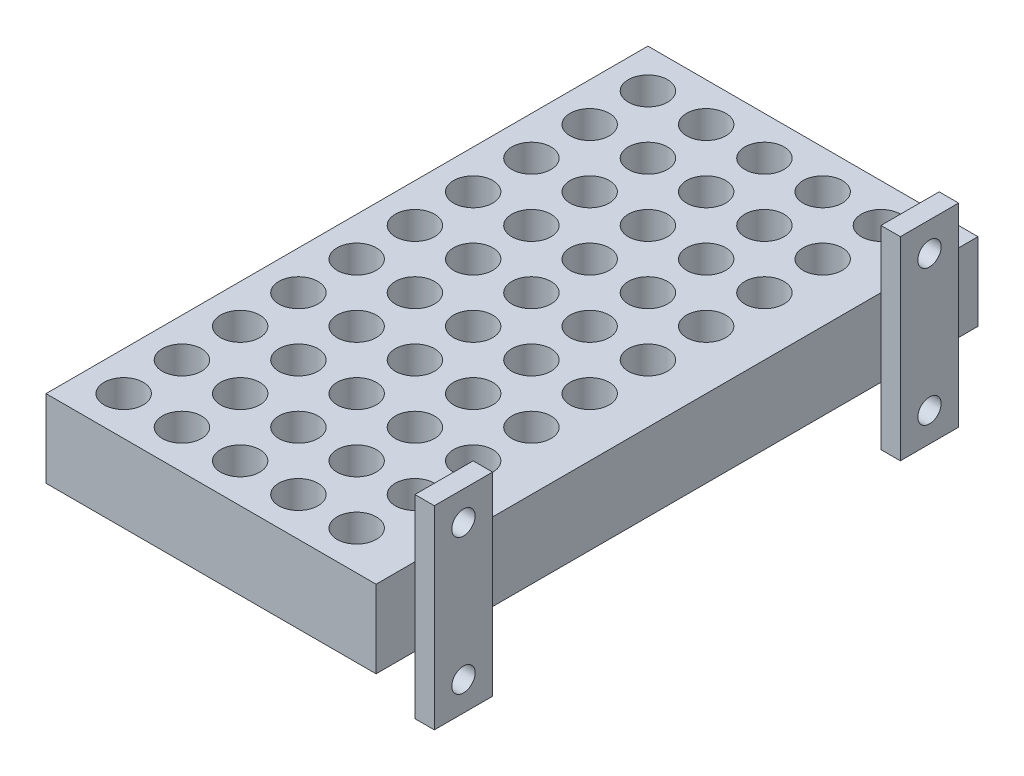
from build123d import *

# Parameters (mm, degrees)
SKETCH1_W           = 85
SKETCH1_H           = 155
BOSS_EXTRUDE1_DEPTH = 20
SKETCH3_R           = 5.05
CUT_EXTRUDE1_DEPTH  = 10
SKETCH5_W           = 15
SKETCH5_H           = 50
BOSS_EXTRUDE2_DEPTH = 5
SKETCH6_R           = 3
CUT_EXTRUDE2_DEPTH  = 5


with BuildPart() as part:
    # Sketch1 → Boss-Extrude1 (new body)
    with BuildSketch(Plane(origin=(0, 0, 0), x_dir=(1, 0, 0), z_dir=(0, 1, 0))):
        with Locations((42.5, 77.5)):
            Rectangle(SKETCH1_W, SKETCH1_H)
    extrude(amount=BOSS_EXTRUDE1_DEPTH)

    # Sketch3 → Cut-Extrude1 (cut)
    with BuildSketch(Plane(origin=(0, 20, 0), x_dir=(1, 0, 0), z_dir=(0, 1, 0))):
        with Locations(Location((10, 145, 0), (0, 0, 270))):
            Circle(SKETCH3_R)
        with Locations(Location((25, 145, 0), (0, 0, 270))):
            Circle(SKETCH3_R)
        with Locations(Location((40, 145, 0), (0, 0, 270))):
            Circle(SKETCH3_R)
        with Locations(Location((55, 145, 0), (0, 0, 270))):
            Circle(SKETCH3_R)
        with Locations(Location((70, 145, 0), (0, 0, 270))):
            Circle(SKETCH3_R)
        with Locations(Location((70, 130, 0), (0, 0, 270))):
            Circle(SKETCH3_R)
        with Locations(Location((55, 130, 0), (0, 0, 270))):
            Circle(SKETCH3_R)
        with Locations(Location((40, 130, 0), (0, 0, 270))):
            Circle(SKETCH3_R)
        with Locations(Location((25, 130, 0), (0, 0, 270))):
            Circle(SKETCH3_R)
        with Locations(Location((10, 130, 0), (0, 0, 270))):
            Circle(SKETCH3_R)
        with Locations(Location((70, 115, 0), (0, 0, 270))):
            Circle(SKETCH3_R)
        with Locations(Location((55, 115, 0), (0, 0, 270))):
            Circle(SKETCH3_R)
        with Locations(Location((40, 115, 0), (0, 0, 270))):
            Circle(SKETCH3_R)
        with Locations(Location((25, 115, 0), (0, 0, 270))):
            Circle(SKETCH3_R)
        with Locations(Location((10, 115, 0), (0, 0, 270))):
            Circle(SKETCH3_R)
        with Locations(Location((70, 100, 0), (0, 0, 270))):
            Circle(SKETCH3_R)
        with Locations(Location((55, 100, 0), (0, 0, 270))):
            Circle(SKETCH3_R)
        with Locations(Location((40, 100, 0), (0, 0, 270))):
            Circle(SKETCH3_R)
        with Locations(Location((25, 100, 0), (0, 0, 270))):
            Circle(SKETCH3_R)
        with Locations(Location((10, 100, 0), (0, 0, 270))):
            Circle(SKETCH3_R)
        with Locations(Location((70, 85, 0), (0, 0, 270))):
            Circle(SKETCH3_R)
        with Locations(Location((55, 85, 0), (0, 0, 270))):
            Circle(SKETCH3_R)
        with Locations(Location((40, 85, 0), (0, 0, 270))):
            Circle(SKETCH3_R)
        with Locations(Location((25, 85, 0), (0, 0, 270))):
            Circle(SKETCH3_R)
        with Locations(Location((10, 85, 0), (0, 0, 270))):
            Circle(SKETCH3_R)
        with Locations(Location((70, 70, 0), (0, 0, 270))):
            Circle(SKETCH3_R)
        with Locations(Location((55, 70, 0), (0, 0, 270))):
            Circle(SKETCH3_R)
        with Locations(Location((40, 70, 0), (0, 0, 270))):
            Circle(SKETCH3_R)
        with Locations(Location((25, 70, 0), (0, 0, 270))):
            Circle(SKETCH3_R)
        with Locations(Location((10, 70, 0), (0, 0, 270))):
            Circle(SKETCH3_R)
        with Locations(Location((70, 55, 0), (0, 0, 270))):
            Circle(SKETCH3_R)
        with Locations(Location((55, 55, 0), (0, 0, 270))):
            Circle(SKETCH3_R)
        with Locations(Location((40, 55, 0), (0, 0, 270))):
            Circle(SKETCH3_R)
        with Locations(Location((25, 55, 0), (0, 0, 270))):
            Circle(SKETCH3_R)
        with Locations(Location((10, 55, 0), (0, 0, 270))):
            Circle(SKETCH3_R)
        with Locations(Location((70, 40, 0), (0, 0, 270))):
            Circle(SKETCH3_R)
        with Locations(Location((55, 40, 0), (0, 0, 270))):
            Circle(SKETCH3_R)
        with Locations(Location((40, 40, 0), (0, 0, 270))):
            Circle(SKETCH3_R)
        with Locations(Location((25, 40, 0), (0, 0, 270))):
            Circle(SKETCH3_R)
        with Locations(Location((10, 40, 0), (0, 0, 270))):
            Circle(SKETCH3_R)
        with Locations(Location((70, 25, 0), (0, 0, 270))):
            Circle(SKETCH3_R)
        with Locations(Location((55, 25, 0), (0, 0, 270))):
            Circle(SKETCH3_R)
        with Locations(Location((40, 25, 0), (0, 0, 270))):
            Circle(SKETCH3_R)
        with Locations(Location((25, 25, 0), (0, 0, 270))):
            Circle(SKETCH3_R)
        with Locations(Location((10, 25, 0), (0, 0, 270))):
            Circle(SKETCH3_R)
        with Locations(Location((70, 10, 0), (0, 0, 270))):
            Circle(SKETCH3_R)
        with Locations(Location((55, 10, 0), (0, 0, 270))):
            Circle(SKETCH3_R)
        with Locations(Location((40, 10, 0), (0, 0, 270))):
            Circle(SKETCH3_R)
        with Locations(Location((25, 10, 0), (0, 0, 270))):
            Circle(SKETCH3_R)
        with Locations(Location((10, 10, 0), (0, 0, 270))):
            Circle(SKETCH3_R)
    extrude(amount=-CUT_EXTRUDE1_DEPTH, mode=Mode.SUBTRACT)

    # Sketch5 → Boss-Extrude2 (add)
    with BuildSketch(Plane(origin=(85, 0, 0), x_dir=(0, 0, -1), z_dir=(1, 0, 0))):
        with Locations((17.5, 10)):
            Rectangle(SKETCH5_W, SKETCH5_H)
        with Locations((137.5, 10)):
            Rectangle(SKETCH5_W, SKETCH5_H)
    extrude(amount=BOSS_EXTRUDE2_DEPTH)

    # Sketch6 → Cut-Extrude2 (cut)
    with BuildSketch(Plane(origin=(90, 0, 0), x_dir=(0, 0, -1), z_dir=(1, 0, 0))):
        with Locations((17.5, 27.5)):
            Circle(SKETCH6_R)
        with Locations((17.5, -7.5)):
            Circle(SKETCH6_R)
        with Locations((137.5, -7.5)):
            Circle(SKETCH6_R)
        with Locations((137.5, 27.5)):
            Circle(SKETCH6_R)
    extrude(amount=-CUT_EXTRUDE2_DEPTH, mode=Mode.SUBTRACT)


solid = part.part
